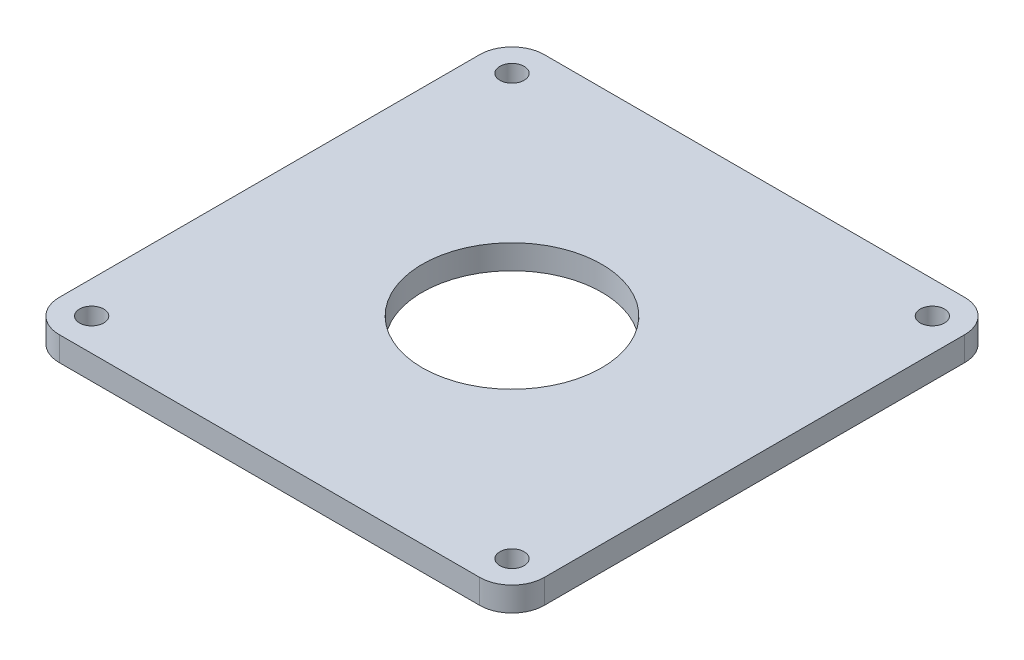
from build123d import *

# Parameters (mm, degrees)
SKETCH_1_R      = 1.5
SKETCH_1_R_2    = 11.1
EXTRUDE_1_DEPTH = 3


with BuildPart() as part:
    # 草图1 → 凸台-拉伸1 (new body)
    with BuildSketch(Plane(origin=(0, 0, 0), x_dir=(1, 0, 0), z_dir=(0, 1, 0))):
        with BuildLine():
            Line((-26, -30), (26, -30))
            ThreePointArc((26, -30), (28.828427125, -28.828427125), (30, -26))
            Line((30, -26), (30, 26))
            ThreePointArc((30, 26), (28.828427125, 28.828427125), (26, 30))
            Line((26, 30), (-26, 30))
            ThreePointArc((-26, 30), (-28.828427125, 28.828427125), (-30, 26))
            Line((-30, 26), (-30, -26))
            ThreePointArc((-30, -26), (-28.828427125, -28.828427125), (-26, -30))
        make_face()
        with Locations(Location((-26, 26, 0), (0, 0, 270))):
            Circle(SKETCH_1_R, mode=Mode.SUBTRACT)
        with Locations(Location((26, 26, 0), (0, 0, 270))):
            Circle(SKETCH_1_R, mode=Mode.SUBTRACT)
        with Locations(Location((26, -26, 0), (0, 0, 270))):
            Circle(SKETCH_1_R, mode=Mode.SUBTRACT)
        with Locations(Location((-26, -26, 0), (0, 0, 270))):
            Circle(SKETCH_1_R, mode=Mode.SUBTRACT)
        with Locations(Location((0, 0, 0), (0, 0, 270))):
            Circle(SKETCH_1_R_2, mode=Mode.SUBTRACT)
    extrude(amount=EXTRUDE_1_DEPTH)


solid = part.part
